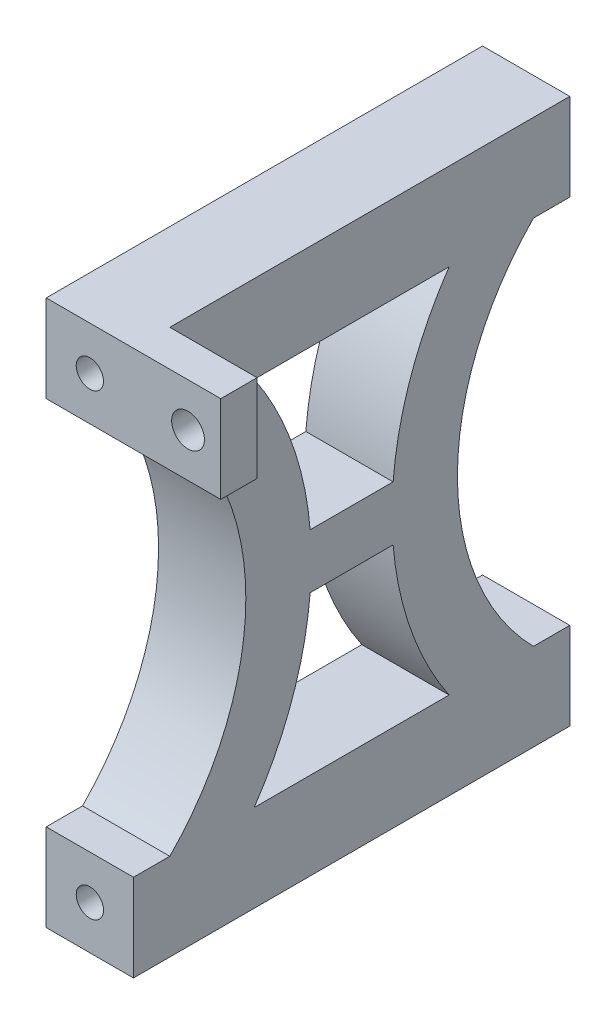
from build123d import *

# Parameters (mm, degrees)
SKETCH1_W             = 8
SKETCH1_H             = 8
SKETCH1_R             = 1.25
BOSS_EXTRUDE1_DEPTH   = 40
BOSS_EXTRUDE1_2_DEPTH = 40
BOSS_EXTRUDE2_DEPTH   = 8
SKETCH3_W             = 3.329640508
SKETCH3_H             = 8
BOSS_EXTRUDE3_DEPTH   = 8
SKETCH4_R             = 1.5
CUT_EXTRUDE1_DEPTH    = 6


with BuildPart() as part:
    # Sketch1 → Boss-Extrude1 (new body)
    with BuildSketch(Plane.XY):
        with Locations((0, 21)):
            Rectangle(SKETCH1_W, SKETCH1_H)
        with Locations((0, 21)):
            Circle(SKETCH1_R, mode=Mode.SUBTRACT)
    extrude(amount=BOSS_EXTRUDE1_DEPTH)



with BuildPart() as body_2:
    # Sketch1 → Boss-Extrude1 2 (new body)
    with BuildSketch(Plane.XY):
        with Locations((0, -21)):
            Rectangle(SKETCH1_W, SKETCH1_H)
        with Locations(Location((0, -21, 0), (0, 0, 180))):
            Circle(SKETCH1_R, mode=Mode.SUBTRACT)
    extrude(amount=BOSS_EXTRUDE1_2_DEPTH)


with BuildPart() as part_1:
    add(part.part)

    add(body_2.part)  # Boss-Extrude2 merges body 2
    # Sketch2 → Boss-Extrude2 (add)
    with BuildSketch(Plane.ZY.offset(4)):
        with BuildLine():
            Line((3.329640508, 17), (11.063985021, 17))
            ThreePointArc((11.063985021, 17), (14.56966913, 10.077818269), (16.196928044, 2.491089763))
            Line((16.196928044, 2.491089763), (23.803071956, 2.491089763))
            ThreePointArc((23.803071956, 2.491089763), (25.43033087, 10.077818269), (28.936014979, 17))
            Line((28.936014979, 17), (36.670359492, 17))
            ThreePointArc((36.670359492, 17), (29.700211914, 0), (36.670359492, -17))
            Line((36.670359492, -17), (28.936014979, -17))
            ThreePointArc((28.936014979, -17), (25.433314102, -10.086246784), (23.804551435, -2.508910237))
            Line((23.804551435, -2.508910237), (16.195448565, -2.508910237))
            ThreePointArc((16.195448565, -2.508910237), (14.566685898, -10.086246784), (11.063985021, -17))
            Line((11.063985021, -17), (3.329640508, -17))
            ThreePointArc((3.329640508, -17), (10.299788086, 0), (3.329640508, 17))
        make_face()
    extrude(amount=-BOSS_EXTRUDE2_DEPTH)

    # Sketch3 → Boss-Extrude3 (add)
    with BuildSketch(Plane(origin=(4, 0, 0), x_dir=(0, 0, -1), z_dir=(1, 0, 0))):
        with Locations((-38.335179746, 21)):
            Rectangle(SKETCH3_W, SKETCH3_H)
    extrude(amount=BOSS_EXTRUDE3_DEPTH)

    # Sketch4 → Cut-Extrude1 (cut)
    with BuildSketch(Plane(origin=(0, 0, 36.670359492), x_dir=(-1, 0, 0), z_dir=(0, 0, -1))):
        with Locations((-9, 21)):
            Circle(SKETCH4_R)
    extrude(amount=-CUT_EXTRUDE1_DEPTH, mode=Mode.SUBTRACT)


solid = part_1.part
